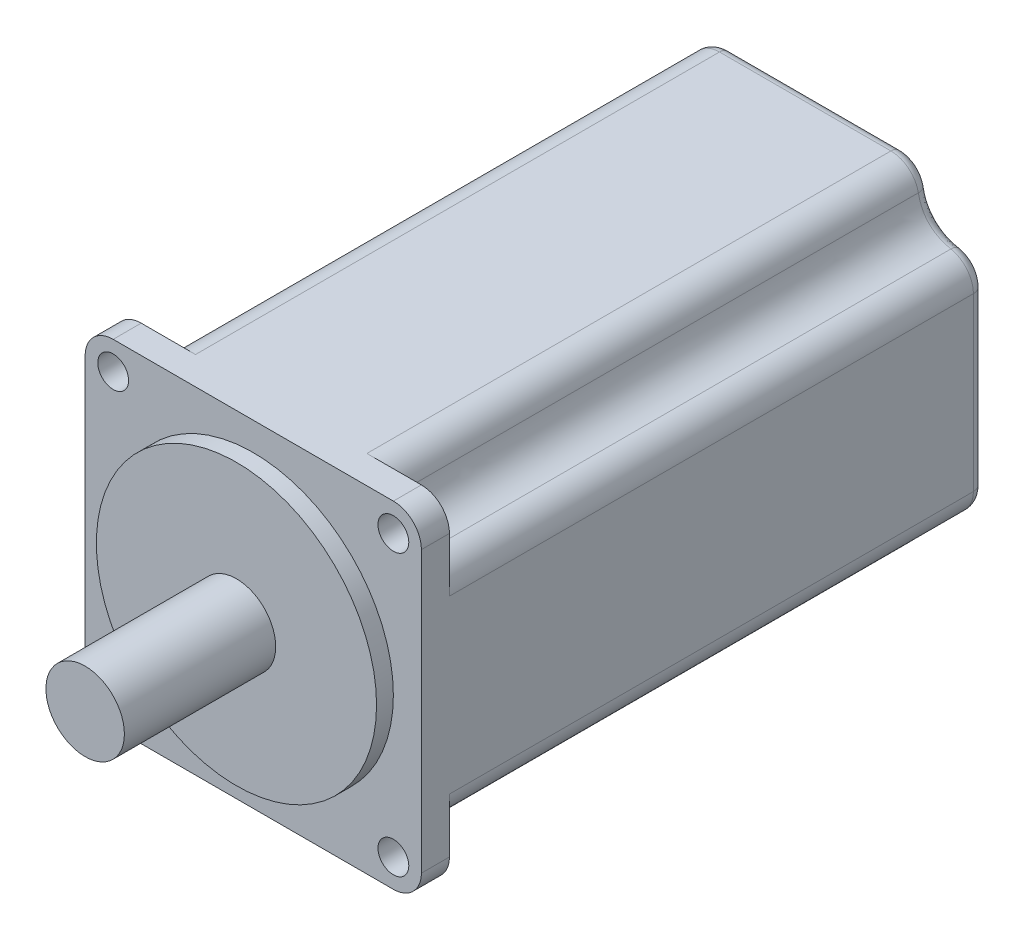
from build123d import *

# Parameters (mm, degrees)
SKETCH1_W           = 60
SKETCH1_H           = 60
SKETCH1_R           = 2.75
BOSS_EXTRUDE1_DEPTH = 5
SKETCH2_R           = 25
BOSS_EXTRUDE2_DEPTH = 3
SKETCH3_R           = 7
BOSS_EXTRUDE3_DEPTH = 27
BOSS_EXTRUDE4_DEPTH = 95.5
FILLET1_R           = 5
FILLET2_R           = 2


with BuildPart() as part:
    # Sketch1 → Boss-Extrude1 (new body)
    with BuildSketch(Plane.XY):
        Rectangle(SKETCH1_W, SKETCH1_H)
        with Locations((-25, 25)):
            Circle(SKETCH1_R, mode=Mode.SUBTRACT)
        with Locations((25, 25)):
            Circle(SKETCH1_R, mode=Mode.SUBTRACT)
        with Locations((25, -25)):
            Circle(SKETCH1_R, mode=Mode.SUBTRACT)
        with Locations((-25, -25)):
            Circle(SKETCH1_R, mode=Mode.SUBTRACT)
    extrude(amount=BOSS_EXTRUDE1_DEPTH)

    # Sketch2 → Boss-Extrude2 (add)
    with BuildSketch(Plane.XY.offset(5)):
        Circle(SKETCH2_R)
    extrude(amount=BOSS_EXTRUDE2_DEPTH)

    # Sketch3 → Boss-Extrude3 (add)
    with BuildSketch(Plane.XY.offset(8)):
        Circle(SKETCH3_R)
    extrude(amount=BOSS_EXTRUDE3_DEPTH)

    # Sketch4 → Boss-Extrude4 (add)
    with BuildSketch(Plane(origin=(0, 0, 0), x_dir=(-1, 0, 0), z_dir=(0, 0, -1))):
        with BuildLine():
            Line((-20, 30), (20, 30))
            add(Edge.make_bspline(
                [(20, 30), (19.298477394, 19.202618981), (30, 20)],
                knots=[0, 0, 0, 1, 1, 1], degree=2))
            Line((30, 20), (30, -20))
            add(Edge.make_bspline(
                [(30, -20), (19.202618981, -19.298477394), (20, -30)],
                knots=[0, 0, 0, 1, 1, 1], degree=2))
            Line((20, -30), (-20, -30))
            add(Edge.make_bspline(
                [(-20, -30), (-19.298477394, -19.202618981), (-30, -20)],
                knots=[0, 0, 0, 1, 1, 1], degree=2))
            Line((-30, -20), (-30, 20))
            add(Edge.make_bspline(
                [(-30, 20), (-19.202618981, 19.298477394), (-20, 30)],
                knots=[0, 0, 0, 1, 1, 1], degree=2))
        make_face()
    extrude(amount=BOSS_EXTRUDE4_DEPTH)

    # Fillet1
    fillet1_edges = [part.edges().sort_by_distance(p)[0] for p in [
        (-30, 30, 2.5),
        (-30, -30, 2.5),
        (30, -30, 2.5),
        (30, 30, 2.5),
        (20, 30, -47.75),
        (30, 20, -47.75),
        (30, -20, -47.75),
        (20, -30, -47.75),
        (-20, -30, -47.75),
        (-30, -20, -47.75),
        (-30, 20, -47.75),
        (-20, 30, -47.75),
    ]]
    fillet(fillet1_edges, radius=FILLET1_R)

    # Fillet2
    fillet2_edges = [part.edges().sort_by_distance(p)[0] for p in [
        (-22.128008414, 22.122643935, -95.5),
        (-18.471813474, 28.868853771, -95.5),
        (-28.866619121, 18.44907167, -95.5),
        (-28.868853771, -18.471813474, -95.5),
        (-18.44907167, -28.866619121, -95.5),
        (18.471813474, -28.868853771, -95.5),
        (28.866619121, -18.44907167, -95.5),
        (28.868853771, 18.471813474, -95.5),
        (18.44907167, 28.866619121, -95.5),
        (-30, -0.012734719, -95.5),
        (-0.012734719, 30, -95.5),
        (0.012734719, -30, -95.5),
        (30, 0.012734719, -95.5),
        (22.122643935, 22.128008414, -95.5),
        (22.128008414, -22.122643935, -95.5),
        (-22.122643935, -22.128008414, -95.5),
    ]]
    fillet(fillet2_edges, radius=FILLET2_R)


solid = part.part
